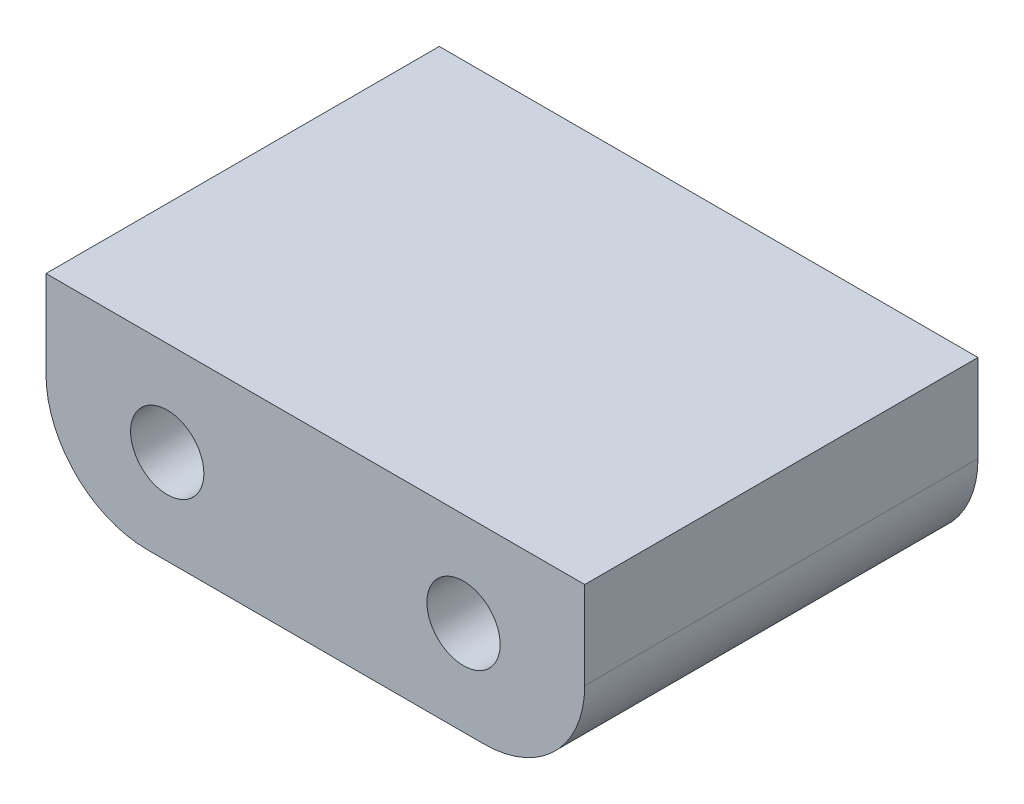
from build123d import *

# Parameters (mm, degrees)
SKETCH1_W                 = 25.4
SKETCH1_H                 = 18.542
BOSS_EXTRUDE1_DEPTH       = 4.445
TAP_DRILL_FOR_8_32_TAP1_D = 3.4544
FILLET1_R                 = 4.7625


with BuildPart() as part:
    # Sketch1 → Boss-Extrude1 (new, symmetric)
    with BuildSketch(Plane(origin=(0, 0, 0), x_dir=(1, 0, 0), z_dir=(0, 1, 0))):
        Rectangle(SKETCH1_W, SKETCH1_H)
    extrude(amount=BOSS_EXTRUDE1_DEPTH, both=True)

    # Tap Drill for #8-32 Tap1 (through all)
    with Locations(Plane.XY.offset(9.271)):
        with Locations((-6.985, 0), (6.985, 0)):
            Hole(TAP_DRILL_FOR_8_32_TAP1_D / 2)

    # Fillet1
    fillet1_edges = [part.edges().sort_by_distance(p)[0] for p in [
        (-12.7, -4.445, 0),
        (12.7, -4.445, 0),
    ]]
    fillet(fillet1_edges, radius=FILLET1_R)


solid = part.part
